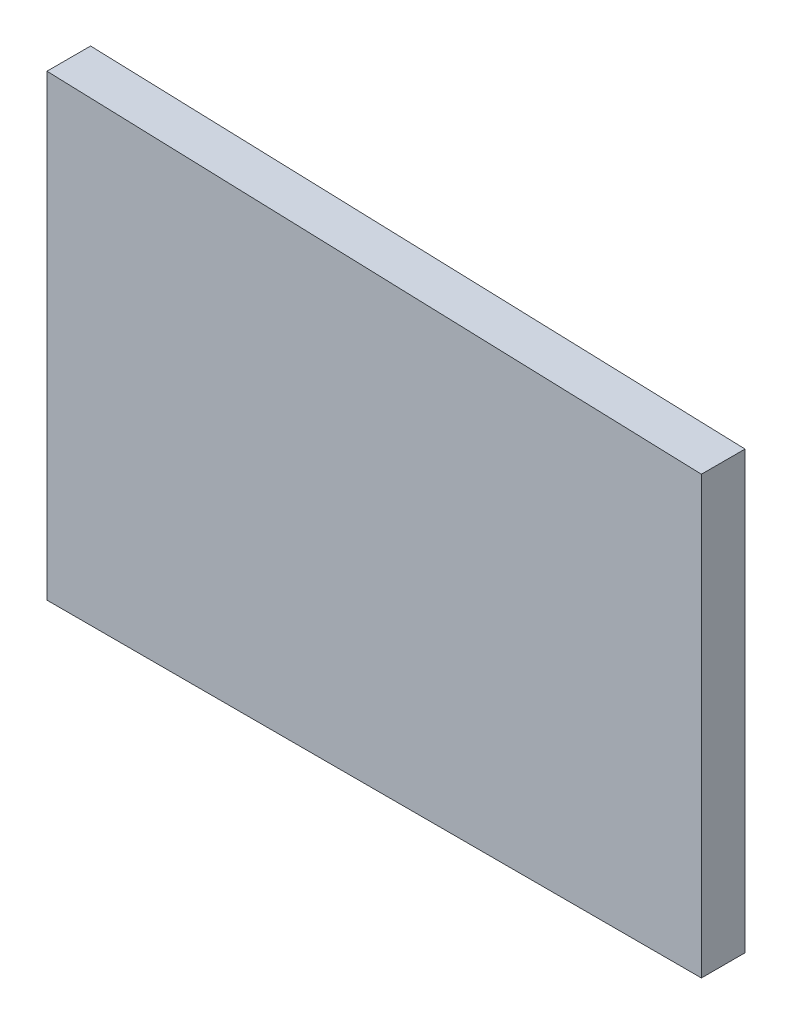
from build123d import *

# Parameters (mm, degrees)
AUFSATZ_LINEAR_AUSTRAGEN1_DEPTH = 2


with BuildPart() as part:
    # Skizze1 → Aufsatz-Linear austragen1 (new body)
    with BuildSketch(Plane.XY):
        Polygon((0, 0), (0, 21), (30, 20), (30, 0), align=None)
    extrude(amount=AUFSATZ_LINEAR_AUSTRAGEN1_DEPTH)


solid = part.part
